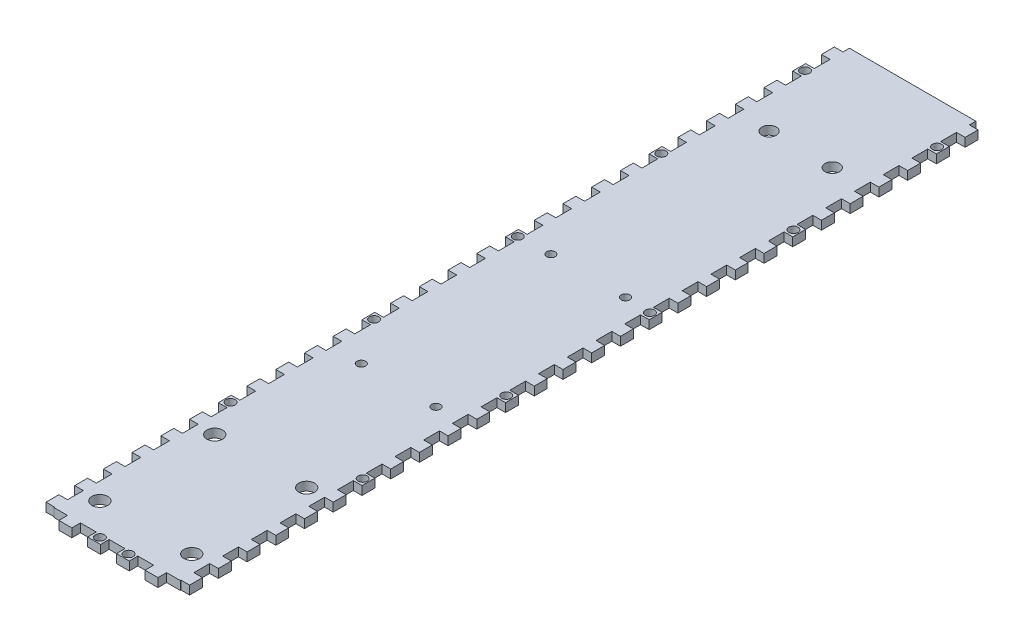
from build123d import *

# Parameters (mm, degrees)
SKETCH1_W               = 44
SKETCH1_H               = 3
BOSS_EXTRUDE1_DEPTH     = 277
SKETCH4_W               = 4.5
SKETCH4_H               = 3
BOSS_EXTRUDE2_DEPTH     = 3
SKETCH5_W               = 4.5
SKETCH5_H               = 3
BOSS_EXTRUDE3_DEPTH     = 3
SKETCH6_W               = 4.5
SKETCH6_H               = 3
BOSS_EXTRUDE4_DEPTH     = 3
SKETCH7_R               = 1.6
CUT_EXTRUDE1_DEPTH      = 3
SKETCH8_R               = 2.5
CUT_EXTRUDE2_DEPTH      = 12
SKETCH9_R               = 1.6
CUT_EXTRUDE3_DEPTH      = 12
CUT_EXTRUDE4_DEPTH      = 282.956246282
CUT_EXTRUDE4_DEPTH_BACK = 282.956246282
SKETCH11_R              = 2.75
SKETCH7_2_R             = 1.6
BOSS_EXTRUDE5_DEPTH     = 3
BOSS_EXTRUDE5_2_DEPTH   = 3
CUT_EXTRUDE5_DEPTH      = 282.956246282
CUT_EXTRUDE5_DEPTH_BACK = 282.956246282
SKETCH12_R              = 1.5


with BuildPart() as part:
    # Sketch1 → Boss-Extrude1 (new body)
    with BuildSketch(Plane.XY):
        with Locations((-8.02006689, 9.02173913)):
            Rectangle(SKETCH1_W, SKETCH1_H)
    extrude(amount=BOSS_EXTRUDE1_DEPTH)

    # Sketch4 → Boss-Extrude2 (add)
    with BuildSketch(Plane(origin=(13.97993311, 0, 0), x_dir=(0, 0, -1), z_dir=(1, 0, 0))):
        with Locations((-274.5, 9.02173913)):
            Rectangle(SKETCH4_W, SKETCH4_H)
        with Locations((-264.5, 9.02173913)):
            Rectangle(SKETCH4_W, SKETCH4_H)
        with Locations((-254.5, 9.02173913)):
            Rectangle(SKETCH4_W, SKETCH4_H)
        with Locations((-244.5, 9.02173913)):
            Rectangle(SKETCH4_W, SKETCH4_H)
        with Locations((-234.5, 9.02173913)):
            Rectangle(SKETCH4_W, SKETCH4_H)
        with Locations((-224.5, 9.02173913)):
            Rectangle(SKETCH4_W, SKETCH4_H)
        with Locations((-214.5, 9.02173913)):
            Rectangle(SKETCH4_W, SKETCH4_H)
        with Locations((-204.5, 9.02173913)):
            Rectangle(SKETCH4_W, SKETCH4_H)
        with Locations((-194.5, 9.02173913)):
            Rectangle(SKETCH4_W, SKETCH4_H)
        with Locations((-184.5, 9.02173913)):
            Rectangle(SKETCH4_W, SKETCH4_H)
        with Locations((-174.5, 9.02173913)):
            Rectangle(SKETCH4_W, SKETCH4_H)
        with Locations((-164.5, 9.02173913)):
            Rectangle(SKETCH4_W, SKETCH4_H)
        with Locations((-154.5, 9.02173913)):
            Rectangle(SKETCH4_W, SKETCH4_H)
        with Locations((-144.5, 9.02173913)):
            Rectangle(SKETCH4_W, SKETCH4_H)
        with Locations((-134.5, 9.02173913)):
            Rectangle(SKETCH4_W, SKETCH4_H)
        with Locations((-124.5, 9.02173913)):
            Rectangle(SKETCH4_W, SKETCH4_H)
        with Locations((-114.5, 9.02173913)):
            Rectangle(SKETCH4_W, SKETCH4_H)
        with Locations((-104.5, 9.02173913)):
            Rectangle(SKETCH4_W, SKETCH4_H)
        with Locations((-94.5, 9.02173913)):
            Rectangle(SKETCH4_W, SKETCH4_H)
        with Locations((-84.5, 9.02173913)):
            Rectangle(SKETCH4_W, SKETCH4_H)
        with Locations((-74.5, 9.02173913)):
            Rectangle(SKETCH4_W, SKETCH4_H)
        with Locations((-64.5, 9.02173913)):
            Rectangle(SKETCH4_W, SKETCH4_H)
        with Locations((-54.5, 9.02173913)):
            Rectangle(SKETCH4_W, SKETCH4_H)
        with Locations((-44.5, 9.02173913)):
            Rectangle(SKETCH4_W, SKETCH4_H)
        with Locations((-34.5, 9.02173913)):
            Rectangle(SKETCH4_W, SKETCH4_H)
        with Locations((-24.5, 9.02173913)):
            Rectangle(SKETCH4_W, SKETCH4_H)
        with Locations((-14.5, 9.02173913)):
            Rectangle(SKETCH4_W, SKETCH4_H)
        with Locations((-4.5, 9.02173913)):
            Rectangle(SKETCH4_W, SKETCH4_H)
    extrude(amount=BOSS_EXTRUDE2_DEPTH)

    # Sketch5 → Boss-Extrude3 (add)
    with BuildSketch(Plane.ZY.offset(30.02006689)):
        with Locations((274.5, 9.02173913)):
            Rectangle(SKETCH5_W, SKETCH5_H)
        with Locations((264.5, 9.02173913)):
            Rectangle(SKETCH5_W, SKETCH5_H)
        with Locations((254.5, 9.02173913)):
            Rectangle(SKETCH5_W, SKETCH5_H)
        with Locations((244.5, 9.02173913)):
            Rectangle(SKETCH5_W, SKETCH5_H)
        with Locations((234.5, 9.02173913)):
            Rectangle(SKETCH5_W, SKETCH5_H)
        with Locations((224.5, 9.02173913)):
            Rectangle(SKETCH5_W, SKETCH5_H)
        with Locations((214.5, 9.02173913)):
            Rectangle(SKETCH5_W, SKETCH5_H)
        with Locations((204.5, 9.02173913)):
            Rectangle(SKETCH5_W, SKETCH5_H)
        with Locations((194.5, 9.02173913)):
            Rectangle(SKETCH5_W, SKETCH5_H)
        with Locations((184.5, 9.02173913)):
            Rectangle(SKETCH5_W, SKETCH5_H)
        with Locations((174.5, 9.02173913)):
            Rectangle(SKETCH5_W, SKETCH5_H)
        with Locations((164.5, 9.02173913)):
            Rectangle(SKETCH5_W, SKETCH5_H)
        with Locations((154.5, 9.02173913)):
            Rectangle(SKETCH5_W, SKETCH5_H)
        with Locations((144.5, 9.02173913)):
            Rectangle(SKETCH5_W, SKETCH5_H)
        with Locations((134.5, 9.02173913)):
            Rectangle(SKETCH5_W, SKETCH5_H)
        with Locations((124.5, 9.02173913)):
            Rectangle(SKETCH5_W, SKETCH5_H)
        with Locations((114.5, 9.02173913)):
            Rectangle(SKETCH5_W, SKETCH5_H)
        with Locations((104.5, 9.02173913)):
            Rectangle(SKETCH5_W, SKETCH5_H)
        with Locations((94.5, 9.02173913)):
            Rectangle(SKETCH5_W, SKETCH5_H)
        with Locations((84.5, 9.02173913)):
            Rectangle(SKETCH5_W, SKETCH5_H)
        with Locations((74.5, 9.02173913)):
            Rectangle(SKETCH5_W, SKETCH5_H)
        with Locations((64.5, 9.02173913)):
            Rectangle(SKETCH5_W, SKETCH5_H)
        with Locations((54.5, 9.02173913)):
            Rectangle(SKETCH5_W, SKETCH5_H)
        with Locations((44.5, 9.02173913)):
            Rectangle(SKETCH5_W, SKETCH5_H)
        with Locations((34.5, 9.02173913)):
            Rectangle(SKETCH5_W, SKETCH5_H)
        with Locations((24.5, 9.02173913)):
            Rectangle(SKETCH5_W, SKETCH5_H)
        with Locations((14.5, 9.02173913)):
            Rectangle(SKETCH5_W, SKETCH5_H)
        with Locations((4.5, 9.02173913)):
            Rectangle(SKETCH5_W, SKETCH5_H)
    extrude(amount=BOSS_EXTRUDE3_DEPTH)

    # Sketch6 → Boss-Extrude4 (add)
    with BuildSketch(Plane.XY.offset(277)):
        with Locations((-23.02006689, 9.02173913)):
            Rectangle(SKETCH6_W, SKETCH6_H)
        with Locations((-13.02006689, 9.02173913)):
            Rectangle(SKETCH6_W, SKETCH6_H)
        with Locations((-3.02006689, 9.02173913)):
            Rectangle(SKETCH6_W, SKETCH6_H)
        with Locations((6.97993311, 9.02173913)):
            Rectangle(SKETCH6_W, SKETCH6_H)
    extrude(amount=BOSS_EXTRUDE4_DEPTH)

    # Sketch7 → Cut-Extrude1 (cut)
    with BuildSketch(Plane.XZ.offset(-7.52173913)):
        with Locations(Location((14.97993311, 264.5, 0), (0, 0, 270))):
            Circle(SKETCH7_R)
        with Locations(Location((-31.02006689, 264.5, 0), (0, 0, 90))):
            Circle(SKETCH7_R)
        with Locations(Location((-31.02006689, 214.5, 0), (0, 0, 90))):
            Circle(SKETCH7_R)
        with Locations(Location((14.97993311, 214.5, 0), (0, 0, 270))):
            Circle(SKETCH7_R)
        with Locations(Location((-31.02006689, 164.5, 0), (0, 0, 90))):
            Circle(SKETCH7_R)
        with Locations(Location((14.97993311, 164.5, 0), (0, 0, 270))):
            Circle(SKETCH7_R)
        with Locations(Location((-31.02006689, 114.5, 0), (0, 0, 90))):
            Circle(SKETCH7_R)
        with Locations(Location((14.97993311, 114.5, 0), (0, 0, 270))):
            Circle(SKETCH7_R)
        with Locations(Location((-31.02006689, 64.5, 0), (0, 0, 90))):
            Circle(SKETCH7_R)
        with Locations(Location((14.97993311, 64.5, 0), (0, 0, 270))):
            Circle(SKETCH7_R)
        with Locations(Location((-31.02006689, 14.5, 0), (0, 0, 90))):
            Circle(SKETCH7_R)
        with Locations(Location((14.97993311, 14.5, 0), (0, 0, 270))):
            Circle(SKETCH7_R)
    extrude(amount=-CUT_EXTRUDE1_DEPTH, mode=Mode.SUBTRACT)

    # Sketch8 → Cut-Extrude2 (cut)
    with BuildSketch(Plane.XZ.offset(-7.52173913)):
        with Locations(Location((-19.02006689, 39, 0), (0, 0, 270))):
            Circle(SKETCH8_R)
        with Locations(Location((2.97993311, 39, 0), (0, 0, 270))):
            Circle(SKETCH8_R)
    extrude(amount=-CUT_EXTRUDE2_DEPTH, mode=Mode.SUBTRACT)

    # Sketch9 → Cut-Extrude3 (cut)
    with BuildSketch(Plane(origin=(0, 7.52173913, 0), x_dir=(-1, 0, 0), z_dir=(0, -1, 0))):
        with Locations(Location((13.02006689, -278, 0), (0, 0, 90))):
            Circle(SKETCH9_R)
        with Locations(Location((3.02006689, -278, 0), (0, 0, 90))):
            Circle(SKETCH9_R)
    extrude(amount=-CUT_EXTRUDE3_DEPTH, mode=Mode.SUBTRACT)

    # Sketch11 → Cut-Extrude4 (cut, two sides: drawn at the far end of the back side and taken through both)
    with BuildSketch(Plane.XZ.offset(-7.52173913).offset(-CUT_EXTRUDE4_DEPTH_BACK)):
        with Locations(Location((-24.02006689, 227, 0), (0, 0, 270))):
            Circle(SKETCH11_R)
        with Locations(Location((7.97993311, 227, 0), (0, 0, 270))):
            Circle(SKETCH11_R)
        with Locations(Location((7.97993311, 267, 0), (0, 0, 270))):
            Circle(SKETCH11_R)
        with Locations(Location((-24.02006689, 267, 0), (0, 0, 270))):
            Circle(SKETCH11_R)
    extrude(amount=CUT_EXTRUDE4_DEPTH + CUT_EXTRUDE4_DEPTH_BACK, mode=Mode.SUBTRACT)


with BuildPart() as body_2:
    # Sketch7<2> → Boss-Extrude5 (new, through all)
    with BuildSketch(Plane.XZ.offset(-7.52173913)):
        with Locations(Location((14.97993311, 264.5, 0), (0, 0, 270))):
            Circle(SKETCH7_2_R)
    extrude(amount=-BOSS_EXTRUDE5_DEPTH)


with BuildPart() as body_3:
    # Sketch7<2> → Boss-Extrude5 2 (new, through all)
    with BuildSketch(Plane.XZ.offset(-7.52173913)):
        with Locations(Location((-31.02006689, 264.5, 0), (0, 0, 90))):
            Circle(SKETCH7_2_R)
    extrude(amount=-BOSS_EXTRUDE5_2_DEPTH)


with BuildPart() as part_1:
    add(part.part)

    # Combine1: union body 3, body 2
    add(body_3.part)
    add(body_2.part)

    # Sketch12 → Cut-Extrude5 (cut, two sides: drawn at the far end of the back side and taken through both)
    with BuildSketch(Plane.XZ.offset(-7.52173913).offset(-CUT_EXTRUDE5_DEPTH_BACK)):
        with Locations(Location((-19.891357694, 114.100708708, 0), (0, 0, 270))):
            Circle(SKETCH12_R)
        with Locations(Location((6.108642306, 114.100708708, 0), (0, 0, 270))):
            Circle(SKETCH12_R)
        with Locations(Location((-19.891357694, 180.100708708, 0), (0, 0, 270))):
            Circle(SKETCH12_R)
        with Locations(Location((6.108642306, 180.100708708, 0), (0, 0, 270))):
            Circle(SKETCH12_R)
    extrude(amount=CUT_EXTRUDE5_DEPTH + CUT_EXTRUDE5_DEPTH_BACK, mode=Mode.SUBTRACT)


solid = part_1.part
